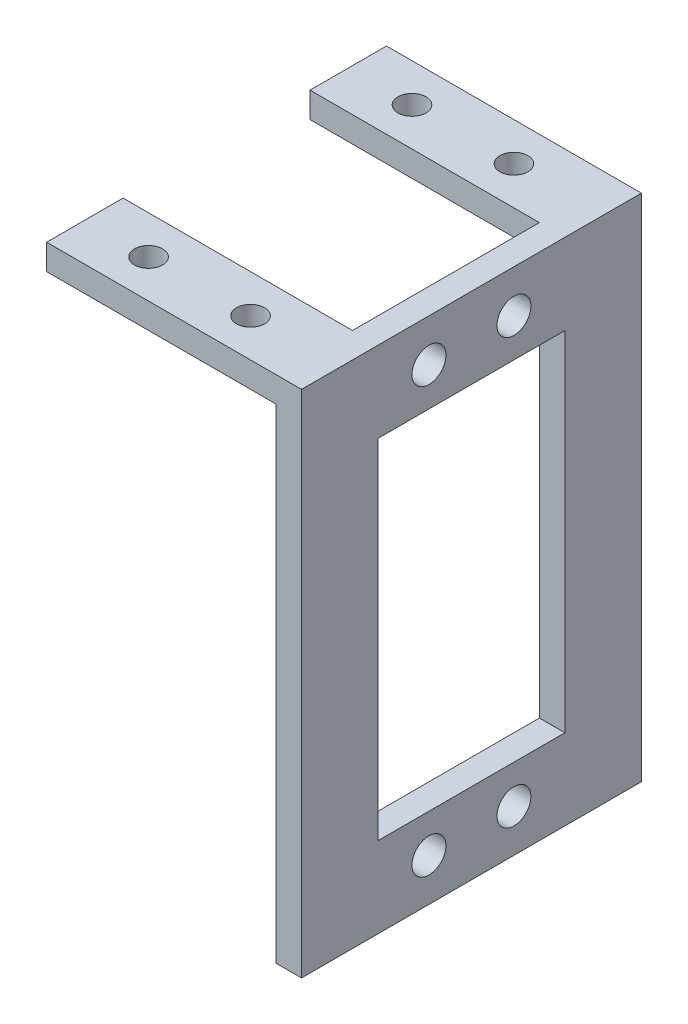
from build123d import *

# Parameters (mm, degrees)
EXTRUDE_1_DEPTH     = 40
SKETCH_2_R          = 1.65
SKETCH_2_W          = 27
SKETCH_2_H          = 22
CUT_EXTRUDE_2_DEPTH = 10
SKETCH_3_R          = 2
SKETCH_3_W          = 22
SKETCH_3_H          = 41
CUT_EXTRUDE_3_DEPTH = 10


with BuildPart() as part:
    # 草图1 → 凸台-拉伸1 (new body)
    with BuildSketch(Plane.XY):
        Polygon((0, 0), (30, 0), (30, -60), (27, -60), (27, -3), (0, -3), align=None)
    extrude(amount=EXTRUDE_1_DEPTH)

    # 草图2 → 切除-拉伸2 (cut)
    with BuildSketch(Plane(origin=(0, 0, 0), x_dir=(1, 0, 0), z_dir=(0, 1, 0))):
        with Locations(Location((7.5, -4.5, 0), (0, 0, 270))):
            Circle(SKETCH_2_R)
        with Locations(Location((19.5, -4.5, 0), (0, 0, 270))):
            Circle(SKETCH_2_R)
        with Locations(Location((19.5, -35.5, 0), (0, 0, 270))):
            Circle(SKETCH_2_R)
        with Locations(Location((7.5, -35.5, 0), (0, 0, 270))):
            Circle(SKETCH_2_R)
        with Locations((13.5, -20)):
            Rectangle(SKETCH_2_W, SKETCH_2_H)
    extrude(amount=-CUT_EXTRUDE_2_DEPTH, mode=Mode.SUBTRACT)

    # 草图3 → 切除-拉伸3 (cut)
    with BuildSketch(Plane(origin=(30, 0, 0), x_dir=(0, 0, -1), z_dir=(1, 0, 0))):
        with Locations(Location((-25, -5, 0), (0, 0, 90))):
            Circle(SKETCH_3_R)
        with Locations(Location((-15, -5, 0), (0, 0, 90))):
            Circle(SKETCH_3_R)
        with Locations(Location((-15, -55, 0), (0, 0, 90))):
            Circle(SKETCH_3_R)
        with Locations(Location((-25, -55, 0), (0, 0, 90))):
            Circle(SKETCH_3_R)
        with Locations((-20, -30)):
            Rectangle(SKETCH_3_W, SKETCH_3_H)
    extrude(amount=-CUT_EXTRUDE_3_DEPTH, mode=Mode.SUBTRACT)


solid = part.part
